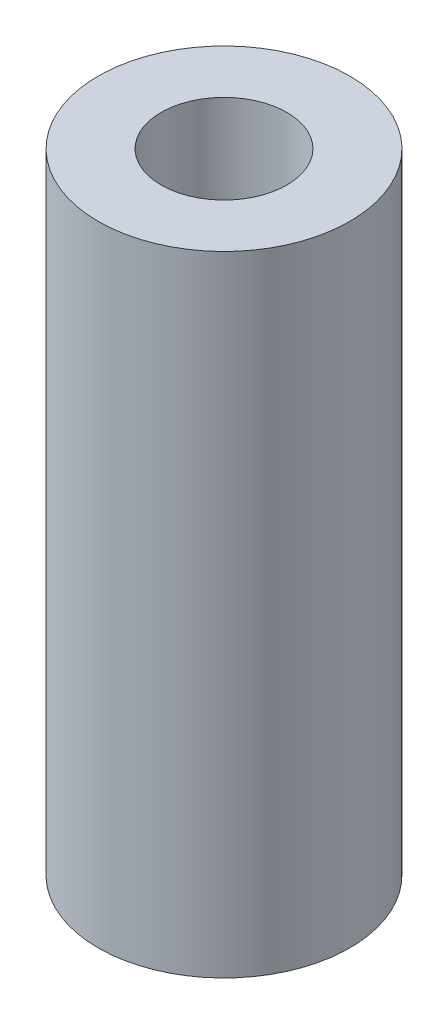
from build123d import *

# Parameters (mm, degrees)
SKETCH1_R           = 6
SKETCH1_R_2         = 3
BOSS_EXTRUDE1_DEPTH = 30


with BuildPart() as part:
    # Sketch1 → Boss-Extrude1 (new body)
    with BuildSketch(Plane(origin=(0, 0, 0), x_dir=(1, 0, 0), z_dir=(0, 1, 0))):
        with Locations(Location((0, 0, 0), (0, 0, 270))):
            Circle(SKETCH1_R)
        with Locations(Location((0, 0, 0), (0, 0, 270))):
            Circle(SKETCH1_R_2, mode=Mode.SUBTRACT)
    extrude(amount=BOSS_EXTRUDE1_DEPTH)


solid = part.part
